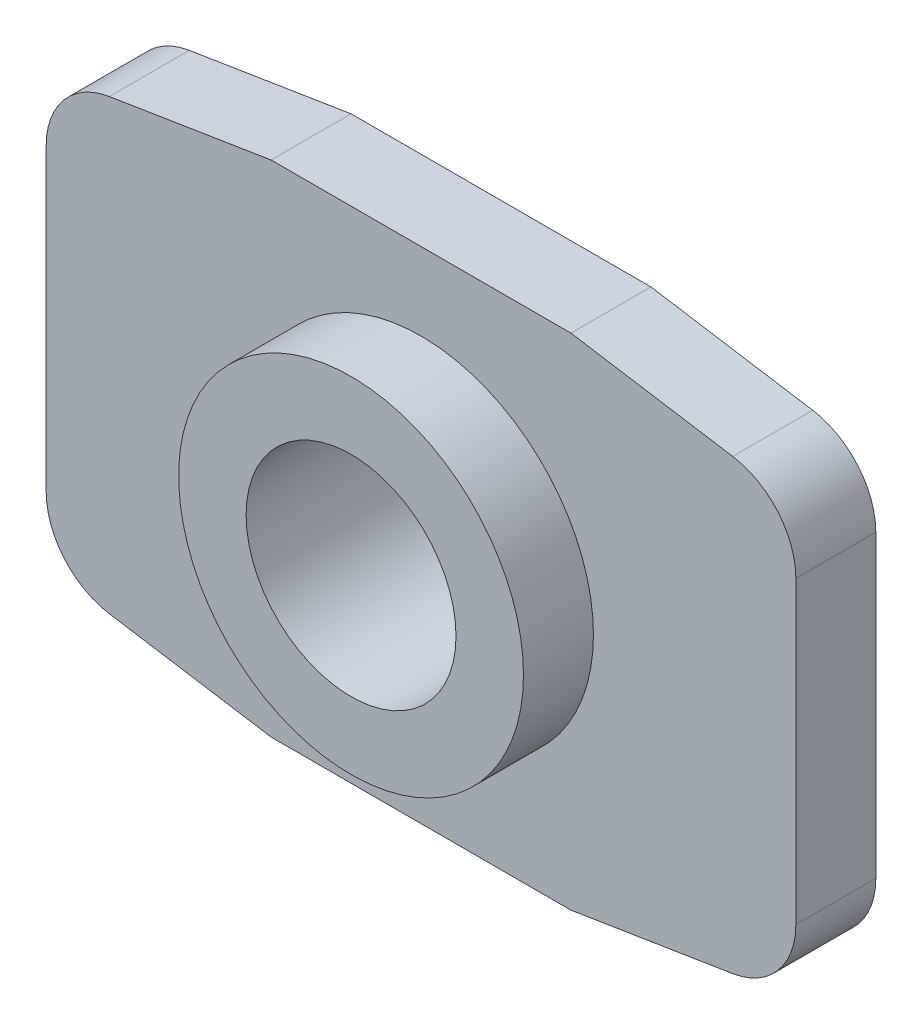
from build123d import *

# Parameters (mm, degrees)
BOSS_EXTRUDE1_DEPTH = 1.6
SKETCH2_R           = 3.45
BOSS_EXTRUDE2_DEPTH = 1.4
TAPPED_HOLE1_D      = 4.2


with BuildPart() as part:
    # Sketch1 → Boss-Extrude1 (new body)
    with BuildSketch(Plane.XY):
        with BuildLine():
            Line((7.5, -3), (7.5, 3))
            ThreePointArc((7.5, 3), (7.141511088, 3.973114811), (6.237396753, 4.481095129))
            Line((6.237396753, 4.481095129), (3, 5))
            Line((3, 5), (-3, 5))
            Line((-3, 5), (-6.237396753, 4.481095129))
            ThreePointArc((-6.237396753, 4.481095129), (-7.141511088, 3.973114811), (-7.5, 3))
            Line((-7.5, 3), (-7.5, -3))
            ThreePointArc((-7.5, -3), (-7.141511088, -3.973114811), (-6.237396753, -4.481095129))
            Line((-6.237396753, -4.481095129), (-3, -5))
            Line((-3, -5), (3, -5))
            Line((3, -5), (6.237396753, -4.481095129))
            ThreePointArc((6.237396753, -4.481095129), (7.141511088, -3.973114811), (7.5, -3))
        make_face()
    extrude(amount=BOSS_EXTRUDE1_DEPTH)

    # Sketch2 → Boss-Extrude2 (add)
    with BuildSketch(Plane.XY.offset(1.6)):
        Circle(SKETCH2_R)
    extrude(amount=BOSS_EXTRUDE2_DEPTH)

    # Tapped Hole1 (through all)
    with Locations(Plane(origin=(0, 0, 0), x_dir=(-1, 0, 0), z_dir=(0, 0, -1))):
        with Locations((0, 0)):
            Hole(TAPPED_HOLE1_D / 2)


solid = part.part
